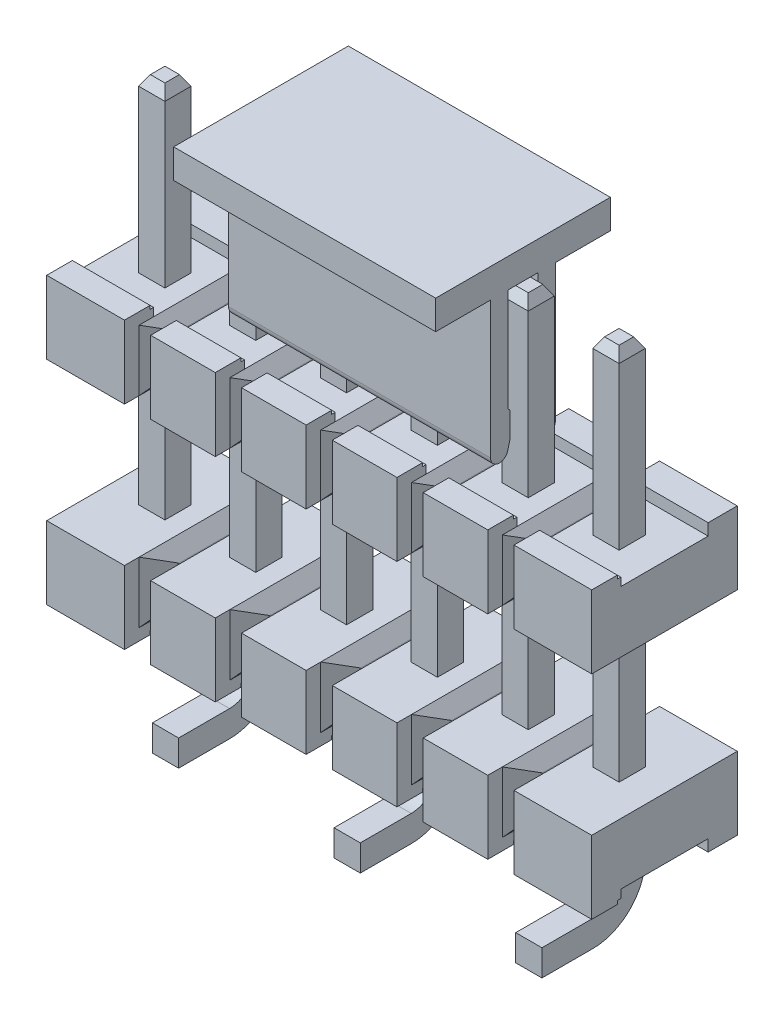
from build123d import *

# Parameters (mm, degrees)
SKETCH1_W                                = 23.7744
SKETCH1_H                                = 6.35
BODY_DEPTH                               = 3.175
BOTTOM_CUT_DEPTH                         = 23.7744
RIB_CUT_1_DEPTH                          = 3.175
RIB_CUT_2_DEPTH                          = 6.35
RIB_PATTERN_COUNT                        = 5
RIB_PATTERN_PITCH                        = 3.9624
SKETCH5_W                                = 1.143
SKETCH5_H                                = 1.143
CONTACT_DEPTH                            = 16.256
CONTACT_CHAMFER_SIZE                     = 0.254
CONTACT_CHAMFER_SIZE2                    = 0.439940905
CONTACT_PATTERN_COUNT                    = 6
CONTACT_PATTERN_PITCH                    = 3.9624
CONTACT_CHAMFER_OF_CONTACT_PATTERN_SIZE2 = 0.254
CONTACT_CHAMFER_OF_CONTACT_PATTERN_SIZE  = 0.439940905
SM_1_DEPTH                               = 1.143
SM_2_DEPTH                               = 1.143
SM_1_PATTERN_COUNT                       = 3
SM_1_PATTERN_PITCH                       = 7.9248
SM_2_PATTERN_COUNT                       = 3
SM_2_PATTERN_PITCH                       = 7.9248
PPP_DEPTH                                = 5.715


with BuildPart() as part:
    # Sketch1 → Body (new body)
    with BuildSketch(Plane(origin=(0, 0, 0), x_dir=(1, 0, 0), z_dir=(0, 1, 0))):
        Rectangle(SKETCH1_W, SKETCH1_H)
    extrude(amount=BODY_DEPTH)

    # Sketch2 → Bottom Cut (cut)
    with BuildSketch(Plane.ZY.offset(11.8872)):
        Polygon((1.905, 0.1524), (2.0574, 0.1524), (2.0574, 0), (-1.905, 0), (-1.905, 0.508), (1.905, 0.508), align=None)
    extrude(amount=-BOTTOM_CUT_DEPTH, mode=Mode.SUBTRACT)

    # Sketch3 → Rib Cut 1 (cut)
    with BuildSketch(Plane(origin=(0, 3.175, 0), x_dir=(1, 0, 0), z_dir=(0, 1, 0))):
        with BuildLine():
            Line((-7.3533, 3.175), (-7.3533, 2.54))
            Line((-7.3533, 2.54), (-7.805516205, 1.302606694))
            ThreePointArc((-7.805516205, 1.302606694), (-7.9248, 1.2192), (-8.044083795, 1.302606694))
            Line((-8.044083795, 1.302606694), (-8.4963, 2.54))
            Line((-8.4963, 2.54), (-8.4963, 3.175))
            Line((-8.4963, 3.175), (-7.3533, 3.175))
        make_face()
        with BuildLine():
            Line((-7.3533, -2.54), (-7.805516205, -1.302606694))
            ThreePointArc((-7.805516205, -1.302606694), (-7.9248, -1.2192), (-8.044083795, -1.302606694))
            Line((-8.044083795, -1.302606694), (-8.4963, -2.54))
            Line((-8.4963, -2.54), (-8.4963, -3.175))
            Line((-8.4963, -3.175), (-7.3533, -3.175))
            Line((-7.3533, -3.175), (-7.3533, -2.54))
        make_face()
    rib_cut_1 = extrude(amount=-RIB_CUT_1_DEPTH, mode=Mode.SUBTRACT)

    # Sketch4 → Rib Cut 2 (cut)
    with BuildSketch(Plane.XY.offset(3.175)):
        with BuildLine():
            Line((-8.4963, 3.175), (-7.3533, 3.175))
            Line((-7.3533, 3.175), (-7.822711827, 2.540655278))
            ThreePointArc((-7.822711827, 2.540655278), (-7.9248, 2.4892), (-8.026888173, 2.540655278))
            Line((-8.026888173, 2.540655278), (-8.4963, 3.175))
        make_face()
        with BuildLine():
            Line((-7.3533, 0), (-7.3533, 0.508))
            Line((-7.3533, 0.508), (-7.822711827, 1.142344722))
            ThreePointArc((-7.822711827, 1.142344722), (-7.9248, 1.1938), (-8.026888173, 1.142344722))
            Line((-8.026888173, 1.142344722), (-8.4963, 0.508))
            Line((-8.4963, 0.508), (-8.4963, 0))
            Line((-8.4963, 0), (-7.3533, 0))
        make_face()
    rib_cut_2 = extrude(amount=-RIB_CUT_2_DEPTH, mode=Mode.SUBTRACT)

    # Rib Pattern: Rib Cut 1, Rib Cut 2 ×5
    with Locations(*[(i * RIB_PATTERN_PITCH, 0, 0) for i in range(1, RIB_PATTERN_COUNT)]):
        add(rib_cut_1, mode=Mode.SUBTRACT)
        add(rib_cut_2, mode=Mode.SUBTRACT)


with BuildPart() as body_2:
    # Body Mirror: mirrored copy
    add(part.part.mirror(Plane.ZX.offset(6.223)))


with BuildPart() as part_1:
    add(part.part)

    add(body_2.part)  # Contact merges body 2
    # Sketch5 → Contact (add)
    with BuildSketch(Plane(origin=(0, 3.175, 0), x_dir=(1, 0, 0), z_dir=(0, 1, 0))):
        with Locations((-9.906, 0)):
            Rectangle(SKETCH5_W, SKETCH5_H)
    contact = extrude(amount=CONTACT_DEPTH)

    # Contact Chamfer
    contact_chamfer_edges = [part_1.edges().sort_by_distance(p)[0] for p in [
        (-10.4775, 19.431, 0),
        (-9.906, 19.431, 0.5715),
        (-9.3345, 19.431, 0),
        (-9.906, 19.431, -0.5715),
    ]]
    contact_chamfer_side = [part_1.faces().sort_by_distance(p)[0] for p in [
        (-9.906, 19.431, 0),
    ]]
    chamfer(contact_chamfer_edges, length=CONTACT_CHAMFER_SIZE, length2=CONTACT_CHAMFER_SIZE2, reference=contact_chamfer_side[0])

    # Contact Pattern: Contact ×6
    with Locations(*[(i * CONTACT_PATTERN_PITCH, 0, 0) for i in range(1, CONTACT_PATTERN_COUNT)]):
        add(contact)

    # Contact Chamfer of Contact Pattern
    contact_chamfer_of_contact_pattern_edges = [part_1.edges().sort_by_distance(p)[0] for p in [
        (-6.5151, 19.431, 0),
        (-5.9436, 19.431, 0.5715),
        (-5.3721, 19.431, 0),
        (-5.9436, 19.431, -0.5715),
        (-2.5527, 19.431, 0),
        (-1.9812, 19.431, 0.5715),
        (-1.4097, 19.431, 0),
        (-1.9812, 19.431, -0.5715),
        (1.4097, 19.431, 0),
        (1.9812, 19.431, 0.5715),
        (2.5527, 19.431, 0),
        (1.9812, 19.431, -0.5715),
        (5.3721, 19.431, 0),
        (5.9436, 19.431, 0.5715),
        (6.5151, 19.431, 0),
        (5.9436, 19.431, -0.5715),
        (9.3345, 19.431, 0),
        (9.906, 19.431, 0.5715),
        (10.4775, 19.431, 0),
        (9.906, 19.431, -0.5715),
    ]]
    chamfer(contact_chamfer_of_contact_pattern_edges, length=CONTACT_CHAMFER_OF_CONTACT_PATTERN_SIZE, length2=CONTACT_CHAMFER_OF_CONTACT_PATTERN_SIZE2)

    # Sketch8 → SM 1 (add)
    with BuildSketch(Plane.ZY.offset(10.4775)):
        with BuildLine():
            Line((-0.5715, 0.508), (0.5715, 0.508))
            Line((0.5715, 0.508), (0.5715, -0.254))
            ThreePointArc((0.5715, -0.254), (-0.098053898, -1.870446102), (-1.7145, -2.54))
            Line((-1.7145, -2.54), (-3.937, -2.54))
            Line((-3.937, -2.54), (-3.937, -1.397))
            Line((-3.937, -1.397), (-1.7145, -1.397))
            ThreePointArc((-1.7145, -1.397), (-0.906276949, -1.062223051), (-0.5715, -0.254))
            Line((-0.5715, -0.254), (-0.5715, 0.508))
        make_face()
    sm_1 = extrude(amount=-SM_1_DEPTH)

    # Sketch7 → SM 2 (add)
    with BuildSketch(Plane.ZY.offset(6.5151)):
        with BuildLine():
            Line((-0.5715, 0.508), (-0.5715, -0.254))
            ThreePointArc((-0.5715, -0.254), (0.098053898, -1.870446102), (1.7145, -2.54))
            Line((1.7145, -2.54), (3.937, -2.54))
            Line((3.937, -2.54), (3.937, -1.397))
            Line((3.937, -1.397), (1.7145, -1.397))
            ThreePointArc((1.7145, -1.397), (0.906276949, -1.062223051), (0.5715, -0.254))
            Line((0.5715, -0.254), (0.5715, 0.508))
            Line((0.5715, 0.508), (-0.5715, 0.508))
        make_face()
    sm_2 = extrude(amount=-SM_2_DEPTH)

    # SM 1 Pattern: SM 1 ×3
    with Locations(*[(i * SM_1_PATTERN_PITCH, 0, 0) for i in range(1, SM_1_PATTERN_COUNT)]):
        add(sm_1)

    # SM 2 Pattern: SM 2 ×3
    with Locations(*[(i * SM_2_PATTERN_PITCH, 0, 0) for i in range(1, SM_2_PATTERN_COUNT)]):
        add(sm_2)

    # Sketch9 → PPP (add, symmetric)
    with BuildSketch(Plane(origin=(0, 0, 0), x_dir=(0, 0, -1), z_dir=(1, 0, 0))):
        with BuildLine():
            Line((-3.81, 20.701), (3.81, 20.701))
            Line((3.81, 20.701), (3.81, 19.431))
            Line((3.81, 19.431), (1.414501731, 19.431))
            Line((1.414501731, 19.431), (1.414501731, 13.462))
            ThreePointArc((1.414501731, 13.462), (1.079933951, 13.083839916), (0.663819059, 13.369827758))
            Line((0.663819059, 13.369827758), (0.45085, 14.224))
            Line((0.45085, 14.224), (0.45085, 14.732))
            Line((0.45085, 14.732), (0.652501731, 14.933651731))
            Line((0.652501731, 14.933651731), (0.652501731, 19.431))
            Line((0.652501731, 19.431), (-0.652501731, 19.431))
            Line((-0.652501731, 19.431), (-0.652501731, 14.933651731))
            Line((-0.652501731, 14.933651731), (-0.45085, 14.732))
            Line((-0.45085, 14.732), (-0.45085, 14.224))
            Line((-0.45085, 14.224), (-0.663819059, 13.369827758))
            ThreePointArc((-0.663819059, 13.369827758), (-1.079933951, 13.083839916), (-1.414501731, 13.462))
            Line((-1.414501731, 13.462), (-1.414501731, 19.431))
            Line((-1.414501731, 19.431), (-3.81, 19.431))
            Line((-3.81, 19.431), (-3.81, 20.701))
        make_face()
    extrude(amount=PPP_DEPTH, both=True)


solid = part_1.part
